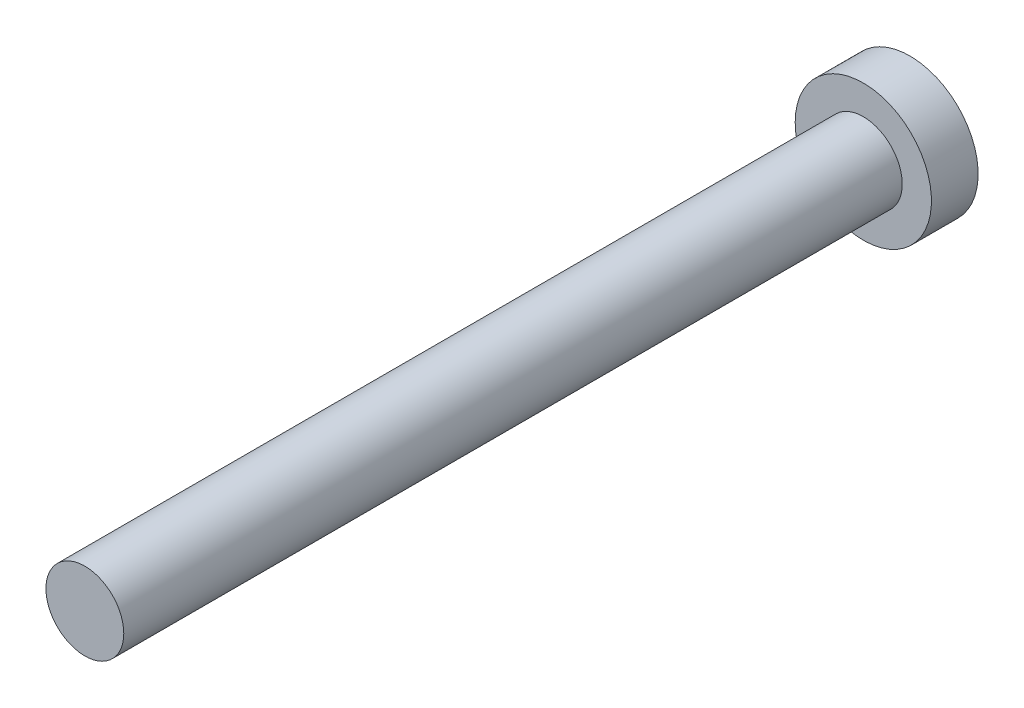
from build123d import *

# Parameters (mm, degrees)
SKETCH2_W           = 2
SKETCH2_H           = 40
SKETCH3_R           = 3.5
BOSS_EXTRUDE1_DEPTH = 2.4


with BuildPart() as part:
    # Sketch2 → Revolve1 (revolve)
    with BuildSketch(Plane(origin=(0, 0, 0), x_dir=(1, 0, 0), z_dir=(0, 1, 0)), mode=Mode.PRIVATE) as revolve1_sk:
        with Locations((-1, 20)):
            Rectangle(SKETCH2_W, SKETCH2_H)
    revolve(revolve1_sk.sketch.rotate(Axis((0, 0, 0), (0, 0, -1)), 180), axis=Axis((0, 0, 0), (0, 0, -1)))

    # Sketch3 → Boss-Extrude1 (add)
    with BuildSketch(Plane(origin=(0, 0, -40), x_dir=(-1, 0, 0), z_dir=(0, 0, -1))):
        Circle(SKETCH3_R)
    extrude(amount=BOSS_EXTRUDE1_DEPTH)


solid = part.part
